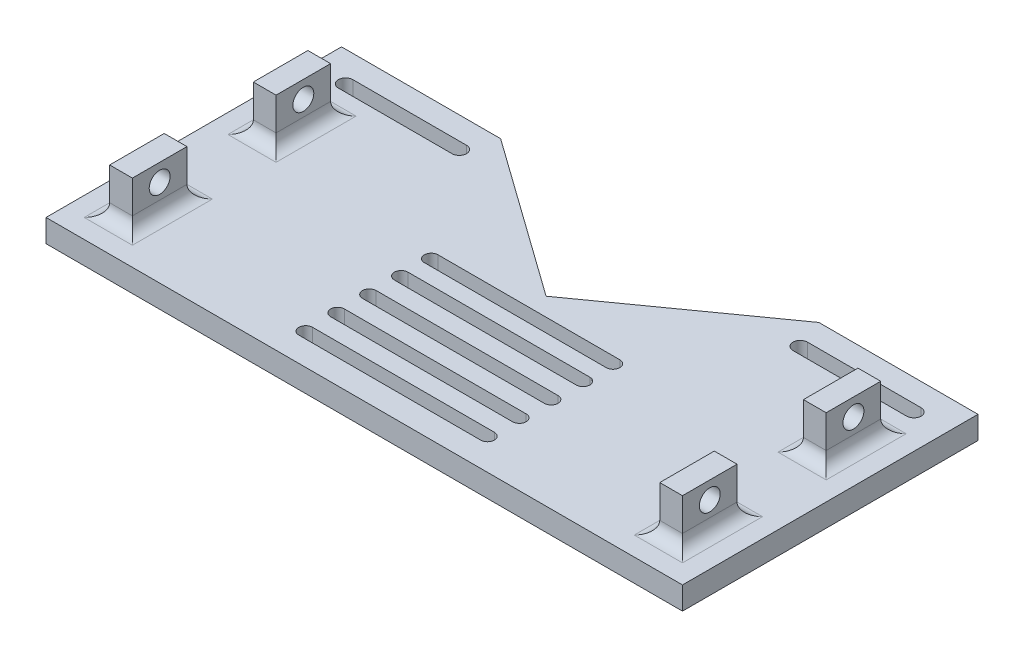
from build123d import *

# Parameters (mm, degrees)
BOSS_EXTRU_1_DEPTH      = 5
ESQUISSE3_W             = 5
ESQUISSE3_H             = 12
BOSS_EXTRU_2_DEPTH      = 10
ESQUISSE4_R             = 2.3
ENL_V_MAT_EXTRU_1_DEPTH = 142.330773303
CONG_1_R                = 2.8


with BuildPart() as part:
    # Esquisse1 → Boss.-Extru.1 (new body)
    with BuildSketch(Plane(origin=(0, 0, 0), x_dir=(1, 0, 0), z_dir=(0, 1, 0))):
        Polygon((70, 45.391491299), (70, 20.391491299), (70, -19.608508701), (-70, -19.608508701), (-70, 20.391491299), (-70, 45.391491299), (-35, 45.391491299), (0, 20.391491299), (35, 45.391491299), align=None)
        with BuildLine():
            ThreePointArc((62.5, 37.191491299), (64.1, 38.791491299), (62.5, 40.391491299))
            Line((62.5, 40.391491299), (37.5, 40.391491299))
            ThreePointArc((37.5, 40.391491299), (35.9, 38.791491299), (37.5, 37.191491299))
            Line((37.5, 37.191491299), (62.5, 37.191491299))
        make_face(mode=Mode.SUBTRACT)
        with BuildLine():
            ThreePointArc((-37.5, 37.194239818), (-35.90137426, 38.792865558), (-37.5, 40.391491299))
            Line((-37.5, 40.391491299), (-62.5, 40.391491299))
            ThreePointArc((-62.5, 40.391491299), (-64.09862574, 38.792865558), (-62.5, 37.194239818))
            Line((-62.5, 37.194239818), (-37.5, 37.194239818))
        make_face(mode=Mode.SUBTRACT)
        with BuildLine():
            ThreePointArc((20.231404284, -14.217017403), (21.731404284, -12.717017403), (20.231404284, -11.217017403))
            Line((20.231404284, -11.217017403), (-19.768595716, -11.217017403))
            ThreePointArc((-19.768595716, -11.217017403), (-21.268595716, -12.717017403), (-19.768595716, -14.217017403))
            Line((-19.768595716, -14.217017403), (20.231404284, -14.217017403))
        make_face(mode=Mode.SUBTRACT)
        with BuildLine():
            ThreePointArc((20.231404284, -7.217017403), (21.731404284, -5.717017403), (20.231404284, -4.217017403))
            Line((20.231404284, -4.217017403), (-19.768595716, -4.217017403))
            ThreePointArc((-19.768595716, -4.217017403), (-21.268595716, -5.717017403), (-19.768595716, -7.217017403))
            Line((-19.768595716, -7.217017403), (20.231404284, -7.217017403))
        make_face(mode=Mode.SUBTRACT)
        with BuildLine():
            ThreePointArc((20.231404284, 13.391491299), (21.731404284, 14.891491299), (20.231404284, 16.391491299))
            Line((20.231404284, 16.391491299), (-19.768595716, 16.391491299))
            ThreePointArc((-19.768595716, 16.391491299), (-21.268595716, 14.891491299), (-19.768595716, 13.391491299))
            Line((-19.768595716, 13.391491299), (20.231404284, 13.391491299))
        make_face(mode=Mode.SUBTRACT)
        with BuildLine():
            ThreePointArc((20.231404284, 6.782982597), (21.731404284, 8.282982597), (20.231404284, 9.782982597))
            Line((20.231404284, 9.782982597), (-19.768595716, 9.782982597))
            ThreePointArc((-19.768595716, 9.782982597), (-21.268595716, 8.282982597), (-19.768595716, 6.782982597))
            Line((-19.768595716, 6.782982597), (20.231404284, 6.782982597))
        make_face(mode=Mode.SUBTRACT)
        with BuildLine():
            ThreePointArc((20.231404284, -0.217017403), (21.731404284, 1.282982597), (20.231404284, 2.782982597))
            Line((20.231404284, 2.782982597), (-19.768595716, 2.782982597))
            ThreePointArc((-19.768595716, 2.782982597), (-21.268595716, 1.282982597), (-19.768595716, -0.217017403))
            Line((-19.768595716, -0.217017403), (20.231404284, -0.217017403))
        make_face(mode=Mode.SUBTRACT)
    extrude(amount=BOSS_EXTRU_1_DEPTH)

    # Esquisse3 → Boss.-Extru.2 (add)
    with BuildSketch(Plane(origin=(0, 5, 0), x_dir=(1, 0, 0), z_dir=(0, 1, 0))):
        with Locations((-60.5, 24.992228824)):
            Rectangle(ESQUISSE3_W, ESQUISSE3_H)
        with Locations((-60.5, -6.608508701)):
            Rectangle(ESQUISSE3_W, ESQUISSE3_H)
        with Locations((60.5, -6.608508701)):
            Rectangle(ESQUISSE3_W, ESQUISSE3_H)
        with Locations((60.5, 24.992228824)):
            Rectangle(ESQUISSE3_W, ESQUISSE3_H)
    extrude(amount=BOSS_EXTRU_2_DEPTH)

    # Esquisse4 → Enlèv. mat.-Extru.1 (cut, through all)
    with BuildSketch(Plane.ZY.offset(63)):
        with Locations((-24.992228824, 11.2)):
            Circle(ESQUISSE4_R)
        with Locations((6.605588836, 11.2)):
            Circle(ESQUISSE4_R)
    extrude(amount=-ENL_V_MAT_EXTRU_1_DEPTH, mode=Mode.SUBTRACT)

    # Congé1
    cong_1_edges = [part.edges().sort_by_distance(p)[0] for p in [
        (-63, 5, -24.992228824),
        (-60.5, 5, -18.992228824),
        (-58, 5, -24.992228824),
        (-60.5, 5, -30.992228824),
        (-63, 5, 6.608508701),
        (-60.5, 5, 12.608508701),
        (-58, 5, 6.608508701),
        (-60.5, 5, 0.608508701),
        (60.5, 5, 0.608508701),
        (58, 5, 6.608508701),
        (60.5, 5, 12.608508701),
        (63, 5, 6.608508701),
        (63, 5, -24.992228824),
        (60.5, 5, -30.992228824),
        (58, 5, -24.992228824),
        (60.5, 5, -18.992228824),
    ]]
    fillet(cong_1_edges, radius=CONG_1_R)


solid = part.part
